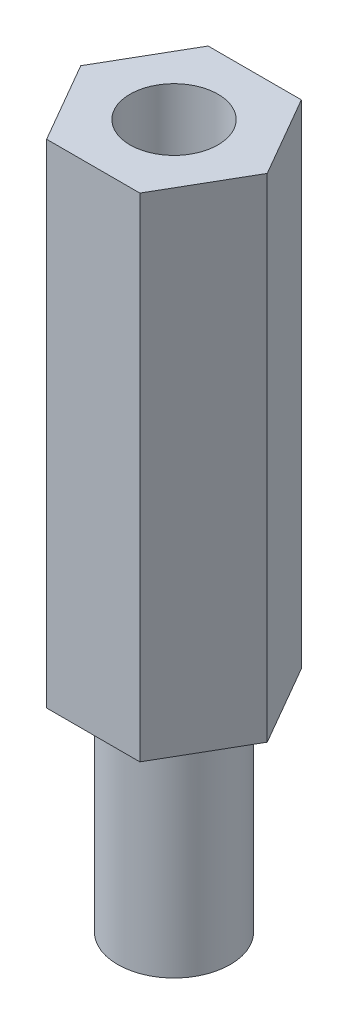
from build123d import *

# Parameters (mm, degrees)
EXTRUDE_1_DEPTH     = 14
SKETCH_6_R          = 1.6
EXTRUDE_2_DEPTH     = 6
SKETCH_7_R          = 1.25
CUT_EXTRUDE_1_DEPTH = 5


with BuildPart() as part:
    # 草图4 → 凸台-拉伸1 (new body)
    with BuildSketch(Plane(origin=(0, 0, 0), x_dir=(1, 0, 0), z_dir=(0, 1, 0))):
        Polygon((1.325, -2.29496732), (2.65, 0), (1.325, 2.29496732), (-1.325, 2.29496732), (-2.65, 0), (-1.325, -2.29496732), align=None)
    extrude(amount=EXTRUDE_1_DEPTH)

    # 草图6 → 凸台-拉伸2 (add)
    with BuildSketch(Plane(origin=(0, 0, 0), x_dir=(-1, 0, 0), z_dir=(0, -1, 0))):
        with Locations(Location((0, 0, 0), (0, 0, 270))):
            Circle(SKETCH_6_R)
    extrude(amount=EXTRUDE_2_DEPTH)

    # 草图7 → 切除-拉伸1 (cut)
    with BuildSketch(Plane(origin=(0, 14, 0), x_dir=(1, 0, 0), z_dir=(0, 1, 0))):
        with Locations(Location((0, 0, 0), (0, 0, 270))):
            Circle(SKETCH_7_R)
    extrude(amount=-CUT_EXTRUDE_1_DEPTH, mode=Mode.SUBTRACT)


solid = part.part
